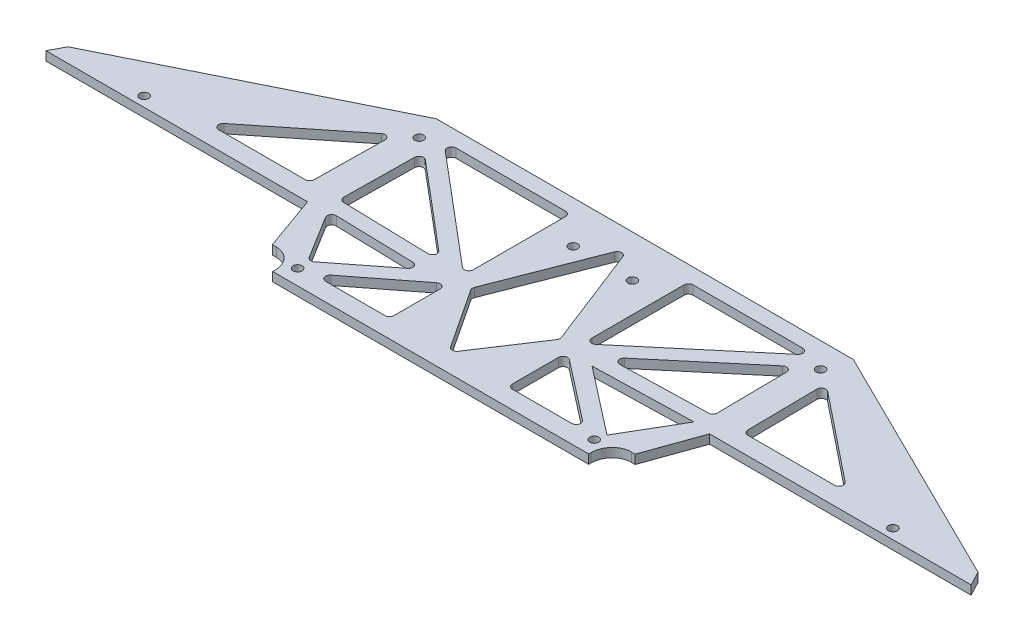
from build123d import *

# Parameters (mm, degrees)
EXTRUDE_1_DEPTH     = 6
SKETCH_2_R          = 3
CUT_EXTRUDE_1_DEPTH = 318.409896722
FILLET_1_R          = 3


with BuildPart() as part:
    # Эскиз1 → Бобышка-Вытянуть1 (new body)
    with BuildSketch(Plane(origin=(0, 0, 0), x_dir=(1, 0, 0), z_dir=(0, 1, 0))):
        with BuildLine():
            Line((309.177837991, -19.526563843), (304.1208994, -9.869304954))
            Line((304.1208994, -9.869304954), (139.339108595, 71.568896564))
            Line((139.339108595, 71.568896564), (-139.339108595, 71.568896564))
            Line((-139.339108595, 71.568896564), (-304.1208994, -9.869304954))
            Line((-304.1208994, -9.869304954), (-309.177837991, -19.526563843))
            Line((-309.177837991, -19.526563843), (-134.367548184, -19.526563843))
            Line((-134.367548184, -19.526563843), (-121.255506601, -56.137850168))
            Line((-121.255506601, -56.137850168), (-118.625, -56.137850168))
            add(Edge.make_bspline(
                [(-118.625, -56.137850168), (-117.73604939, -56.137850168), (-116.863581866, -56.233656219), (-115.578458559, -56.514409609), (-115.154045806, -56.631020903), (-114.313330245, -56.91138161), (-113.900260231, -57.074299025), (-112.700337662, -57.62175838), (-111.944761063, -58.066913832), (-110.877012416, -58.853219635), (-110.532359667, -59.135456666), (-109.879727858, -59.72693005), (-109.259674848, -60.348234431), (-108.702715184, -61.027310664), (-108.177181377, -61.735162196), (-107.929156775, -62.105311768), (-107.245045383, -63.239220647), (-106.864936074, -64.029470546), (-106.249383942, -65.67531101), (-106.013919219, -66.536987879), (-105.703263791, -68.270165649), (-105.625, -69.14709382), (-105.625, -70.034522256)],
                knots=[0, 0, 0, 0, 0.125, 0.125, 0.1875, 0.1875, 0.25, 0.25, 0.375, 0.375, 0.4375, 0.4375, 0.5, 0.5625, 0.5625, 0.625, 0.625, 0.75, 0.75, 0.875, 0.875, 1, 1, 1, 1], degree=3))
            Line((-105.625, -70.034522256), (-105.625, -71.568896564))
            Line((-105.625, -71.568896564), (105.625, -71.568896564))
            Line((105.625, -71.568896564), (105.625, -70.034522256))
            add(Edge.make_bspline(
                [(105.625, -70.034522256), (105.625, -69.146188417), (105.703417019, -68.271043449), (105.934814701, -66.977461208), (106.031042325, -66.549478705), (106.262646487, -65.700098111), (106.398816423, -65.276664427), (106.863134882, -64.032516396), (107.243720136, -63.242761719), (107.92127714, -62.117712579), (108.165026803, -61.75269229), (108.68986891, -61.043508559), (108.97254159, -60.69784736), (109.860275675, -59.715540738), (110.508242307, -59.12685949), (111.565919809, -58.344904551), (111.932862686, -58.101210315), (112.6970874, -57.649589406), (113.090639287, -57.444106887), (114.289999629, -56.895653779), (115.12040105, -56.616320302), (116.41376972, -56.331041481), (116.854501373, -56.258404071), (117.736783928, -56.162064753), (118.179895928, -56.137850168), (118.625, -56.137850168)],
                knots=[0, 0, 0, 0, 0.125, 0.125, 0.1875, 0.1875, 0.25, 0.25, 0.375, 0.375, 0.4375, 0.4375, 0.5, 0.5, 0.625, 0.625, 0.6875, 0.6875, 0.75, 0.75, 0.875, 0.875, 0.9375, 0.9375, 1, 1, 1, 1], degree=3))
            Line((118.625, -56.137850168), (121.255506601, -56.137850168))
            Line((121.255506601, -56.137850168), (134.367548184, -19.526563843))
            Line((134.367548184, -19.526563843), (309.177837991, -19.526563843))
        make_face()
        Polygon((-214.327282353, -7.526563843), (-144.945354376, -7.526563843), (-144.232879574, 48.548456393), align=None, mode=Mode.SUBTRACT)
        Polygon((-124.234493737, 48.29436204), (-124.94696854, -7.780658197), (-55.587438417, -9.543471524), align=None, mode=Mode.SUBTRACT)
        Polygon((-39.584708108, 61.232071167), (-124.070110529, 61.232071167), (-39.584708108, -9.950190344), align=None, mode=Mode.SUBTRACT)
        Polygon((-29.584708108, -14.755399706), (0, -59.568896564), (29.584708108, -14.755399706), (0, 61.232071167), align=None, mode=Mode.SUBTRACT)
        Polygon((-90.997346953, -59.568896564), (-39.584708108, -59.568896564), (-39.584708108, -19.560609068), align=None, mode=Mode.SUBTRACT)
        Polygon((-99.853084476, -54.031919172), (-55.841512263, -19.540243327), (-122.220473813, -17.853182906), align=None, mode=Mode.SUBTRACT)
        Polygon((124.070110529, 61.232071167), (39.584708108, 61.232071167), (39.584708108, -9.950190344), align=None, mode=Mode.SUBTRACT)
        Polygon((124.94696854, -7.780658197), (124.234493737, 48.29436204), (55.587438417, -9.543471524), align=None, mode=Mode.SUBTRACT)
        Polygon((100.785410724, -54.522211893), (122.220473813, -17.853182906), (55.841512263, -19.540243327), align=None, mode=Mode.SUBTRACT)
        Polygon((90.997346953, -59.568896564), (39.584708108, -19.560609068), (39.584708108, -59.568896564), align=None, mode=Mode.SUBTRACT)
        Polygon((144.945354376, -7.526563843), (214.327282353, -7.526563843), (144.232879574, 48.548456393), align=None, mode=Mode.SUBTRACT)
    extrude(amount=EXTRUDE_1_DEPTH)

    # Эскиз2 → Вырез-Вытянуть1 (cut, through all)
    with BuildSketch(Plane(origin=(0, 6, 0), x_dir=(1, 0, 0), z_dir=(0, 1, 0))):
        with Locations(Location((-250.253196754, -12.871881409, 0), (0, 0, 270))):
            Circle(SKETCH_2_R)
        with Locations(Location((-134.151495051, 54.89026378, 0), (0, 0, 270))):
            Circle(SKETCH_2_R)
        with Locations(Location((-99.138834526, -61.401125149, 0), (0, 0, 270))):
            Circle(SKETCH_2_R)
        with Locations(Location((-19.792354054, 43.436505789, 0), (0, 0, 270))):
            Circle(SKETCH_2_R)
        with Locations(Location((19.792354054, 43.436505789, 0), (0, 0, 270))):
            Circle(SKETCH_2_R)
        with Locations(Location((99.138834526, -61.401125149, 0), (0, 0, 270))):
            Circle(SKETCH_2_R)
        with Locations(Location((134.151495051, 54.89026378, 0), (0, 0, 270))):
            Circle(SKETCH_2_R)
        with Locations(Location((250.253196754, -12.871881409, 0), (0, 0, 270))):
            Circle(SKETCH_2_R)
    extrude(amount=-CUT_EXTRUDE_1_DEPTH, mode=Mode.SUBTRACT)

    # Скругление1
    fillet_1_edges = [part.edges().sort_by_distance(p)[0] for p in [
        (-122.220473813, 3, 17.853182906),
        (-99.853084476, 3, 54.031919172),
        (-55.841512263, 3, 19.540243327),
        (39.584708108, 3, 9.950190344),
        (124.070110529, 3, -61.232071167),
        (39.584708108, 3, -61.232071167),
        (55.587438417, 3, 9.543471524),
        (124.94696854, 3, 7.780658197),
        (124.234493737, 3, -48.29436204),
        (39.584708108, 3, 59.568896564),
        (90.997346953, 3, 59.568896564),
        (39.584708108, 3, 19.560609068),
        (144.232879574, 3, -48.548456393),
        (144.945354376, 3, 7.526563843),
        (214.327282353, 3, 7.526563843),
        (-144.232879574, 3, -48.548456393),
        (-214.327282353, 3, 7.526563843),
        (-144.945354376, 3, 7.526563843),
        (-55.587438417, 3, 9.543471524),
        (-124.234493737, 3, -48.29436204),
        (-124.94696854, 3, 7.780658197),
        (-39.584708108, 3, 9.950190344),
        (-39.584708108, 3, -61.232071167),
        (-124.070110529, 3, -61.232071167),
        (0, 3, -61.232071167),
        (-29.584708108, 3, 14.755399706),
        (0, 3, 59.568896564),
        (29.584708108, 3, 14.755399706),
        (-39.584708108, 3, 19.560609068),
        (-90.997346953, 3, 59.568896564),
        (-39.584708108, 3, 59.568896564),
    ]]
    fillet(fillet_1_edges, radius=FILLET_1_R)


solid = part.part
